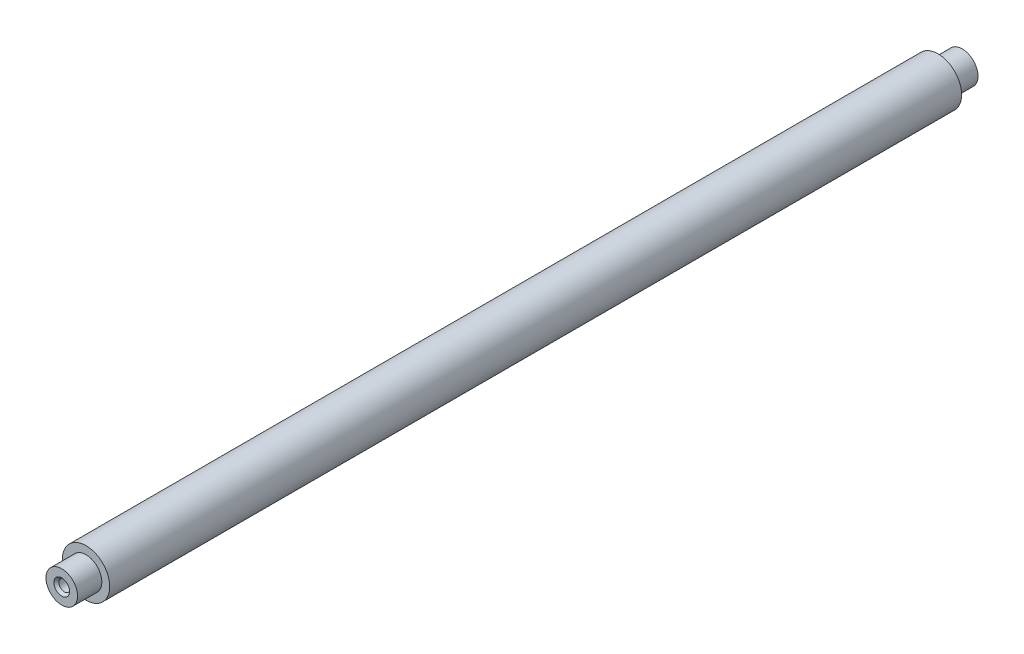
from build123d import *

# Parameters (mm, degrees)
SKETCH1_R                        = 9.525
BOSS_EXTRUDE1_DEPTH              = 342.9
SKETCH2_R                        = 6.35
BOSS_EXTRUDE2_DEPTH              = 9.779
F_12_24_TAPPED_HOLE1_D           = 4.4958
F_12_24_TAPPED_HOLE1_DEPTH       = 25.4
F_12_24_TAPPED_HOLE1_CSINK_D     = 6.35
F_12_24_TAPPED_HOLE1_CSINK_ANGLE = 82
F_12_24_TAPPED_HOLE1_TIP         = 1.350674586
BOSS_EXTRUDE3_START              = 9.779
SKETCH5_R                        = 6.35
BOSS_EXTRUDE3_DEPTH              = 9.779
F_12_24_TAPPED_HOLE2_D           = 4.4958
F_12_24_TAPPED_HOLE2_DEPTH       = 25.4
F_12_24_TAPPED_HOLE2_CSINK_D     = 6.35
F_12_24_TAPPED_HOLE2_CSINK_ANGLE = 82
F_12_24_TAPPED_HOLE2_TIP         = 1.350674586


with BuildPart() as part:
    # Sketch1 → Boss-Extrude1 (new body)
    with BuildSketch(Plane.XY):
        Circle(SKETCH1_R)
    extrude(amount=BOSS_EXTRUDE1_DEPTH)

    # Sketch2 → Boss-Extrude2 (add)
    with BuildSketch(Plane.XY.offset(342.9)):
        Circle(SKETCH2_R)
    extrude(amount=BOSS_EXTRUDE2_DEPTH)

    # #12-24 Tapped Hole1
    with Locations(Plane.XY.offset(352.679)):
        with Locations((0, 0)):
            CounterSinkHole(F_12_24_TAPPED_HOLE1_D / 2, F_12_24_TAPPED_HOLE1_CSINK_D / 2, depth=F_12_24_TAPPED_HOLE1_DEPTH, counter_sink_angle=F_12_24_TAPPED_HOLE1_CSINK_ANGLE)
            with Locations((0, 0, -(F_12_24_TAPPED_HOLE1_DEPTH + F_12_24_TAPPED_HOLE1_TIP / 2))):  # 118° drill point
                Cone(0, F_12_24_TAPPED_HOLE1_D / 2, F_12_24_TAPPED_HOLE1_TIP, mode=Mode.SUBTRACT)

    # Sketch5 → Boss-Extrude3 (add)
    with BuildSketch(Plane(origin=(0, 0, 0), x_dir=(-1, 0, 0), z_dir=(0, 0, -1)).offset(BOSS_EXTRUDE3_START)):
        with Locations(Location((0, 0, 0), (0, 0, 180))):
            Circle(SKETCH5_R)
    extrude(amount=-BOSS_EXTRUDE3_DEPTH)

    # #12-24 Tapped Hole2
    with Locations(Plane(origin=(0, 0, -9.779), x_dir=(-1, 0, 0), z_dir=(0, 0, -1))):
        with Locations((0, 0)):
            CounterSinkHole(F_12_24_TAPPED_HOLE2_D / 2, F_12_24_TAPPED_HOLE2_CSINK_D / 2, depth=F_12_24_TAPPED_HOLE2_DEPTH, counter_sink_angle=F_12_24_TAPPED_HOLE2_CSINK_ANGLE)
            with Locations((0, 0, -(F_12_24_TAPPED_HOLE2_DEPTH + F_12_24_TAPPED_HOLE2_TIP / 2))):  # 118° drill point
                Cone(0, F_12_24_TAPPED_HOLE2_D / 2, F_12_24_TAPPED_HOLE2_TIP, mode=Mode.SUBTRACT)


solid = part.part
